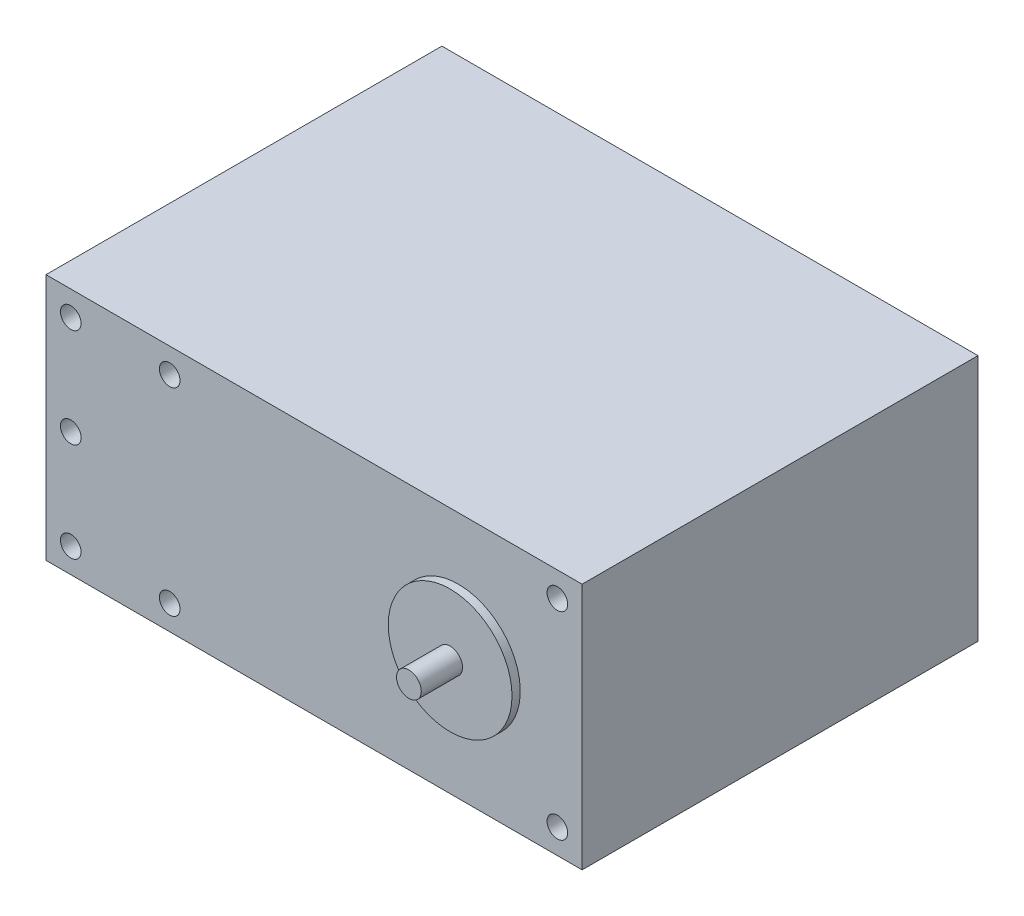
from build123d import *

# Parameters (mm, degrees)
SKETCH_1_W          = 65
SKETCH_1_H          = 30
EXTRUDE_1_DEPTH     = 48
SKETCH_2_R          = 1.25
CUT_EXTRUDE_1_DEPTH = 3
SKETCH_3_R          = 7.5
SKETCH_3_R_2        = 1.5
EXTRUDE_2_DEPTH     = 1
SKETCH_4_R          = 1.5
EXTRUDE_3_DEPTH     = 6
CUT_EXTRUDE_START   = -4
SKETCH_5_R          = 1.25
CUT_EXTRUDE_2_DEPTH = 4
EXTRUDE_START       = 1
SKETCH_6_R          = 7.5
SKETCH_6_R_2        = 1.5
EXTRUDE_4_DEPTH     = 1
EXTRUDE_START_2     = 6
SKETCH_7_R          = 1.5
EXTRUDE_5_DEPTH     = 6


with BuildPart() as part:
    # ｽｹｯﾁ1 → ﾎﾞｽ - 押し出し1 (new body)
    with BuildSketch(Plane.XY):
        with Locations((32.5, 15)):
            Rectangle(SKETCH_1_W, SKETCH_1_H)
    extrude(amount=EXTRUDE_1_DEPTH)

    # ｽｹｯﾁ2 → ｶｯﾄ - 押し出し1 (cut)
    with BuildSketch(Plane.XY.offset(48)):
        with Locations((3, 27)):
            Circle(SKETCH_2_R)
        with Locations((15, 27)):
            Circle(SKETCH_2_R)
        with Locations((3, 3)):
            Circle(SKETCH_2_R)
        with Locations((3, 15)):
            Circle(SKETCH_2_R)
        with Locations((15, 3)):
            Circle(SKETCH_2_R)
        with Locations((62, 27)):
            Circle(SKETCH_2_R)
        with Locations((62, 3)):
            Circle(SKETCH_2_R)
    extrude(amount=-CUT_EXTRUDE_1_DEPTH, mode=Mode.SUBTRACT)

    # ｽｹｯﾁ3 → ﾎﾞｽ - 押し出し2 (add)
    with BuildSketch(Plane.XY.offset(48)):
        with Locations(Location((50, 15, 0), (0, 0, 180))):
            Circle(SKETCH_3_R)
        with Locations((50, 15)):
            Circle(SKETCH_3_R_2, mode=Mode.SUBTRACT)
    extrude(amount=EXTRUDE_2_DEPTH)

    # ｽｹｯﾁ4 → ﾎﾞｽ - 押し出し3 (add)
    with BuildSketch(Plane.XY.offset(48)):
        with Locations((50, 15)):
            Circle(SKETCH_4_R)
    extrude(amount=EXTRUDE_3_DEPTH)

    # ｽｹｯﾁ5 → ｶｯﾄ - 押し出し2 (cut)
    with BuildSketch(Plane(origin=(0, 0, 0), x_dir=(-1, 0, 0), z_dir=(0, 0, -1)).offset(CUT_EXTRUDE_START)):
        with Locations(Location((-3, 3, 0), (0, 0, 180))):
            Circle(SKETCH_5_R)
        with Locations(Location((-3, 27, 0), (0, 0, 180))):
            Circle(SKETCH_5_R)
        with Locations((-27, 27)):
            Circle(SKETCH_5_R)
        with Locations((-27, 3)):
            Circle(SKETCH_5_R)
        with Locations(Location((-62, 27, 0), (0, 0, 180))):
            Circle(SKETCH_5_R)
        with Locations(Location((-62, 3, 0), (0, 0, 180))):
            Circle(SKETCH_5_R)
    extrude(amount=CUT_EXTRUDE_2_DEPTH, mode=Mode.SUBTRACT)

    # ｽｹｯﾁ6 → ﾎﾞｽ - 押し出し4 (add)
    with BuildSketch(Plane(origin=(0, 0, 0), x_dir=(-1, 0, 0), z_dir=(0, 0, -1)).offset(EXTRUDE_START)):
        with Locations((-50, 15)):
            Circle(SKETCH_6_R)
        with Locations(Location((-50, 15, 0), (0, 0, 180))):
            Circle(SKETCH_6_R_2, mode=Mode.SUBTRACT)
    extrude(amount=-EXTRUDE_4_DEPTH)

    # ｽｹｯﾁ7 → ﾎﾞｽ - 押し出し5 (add)
    with BuildSketch(Plane(origin=(0, 0, 0), x_dir=(-1, 0, 0), z_dir=(0, 0, -1)).offset(EXTRUDE_START_2)):
        with Locations(Location((-50, 15, 0), (0, 0, 180))):
            Circle(SKETCH_7_R)
    extrude(amount=-EXTRUDE_5_DEPTH)


solid = part.part
